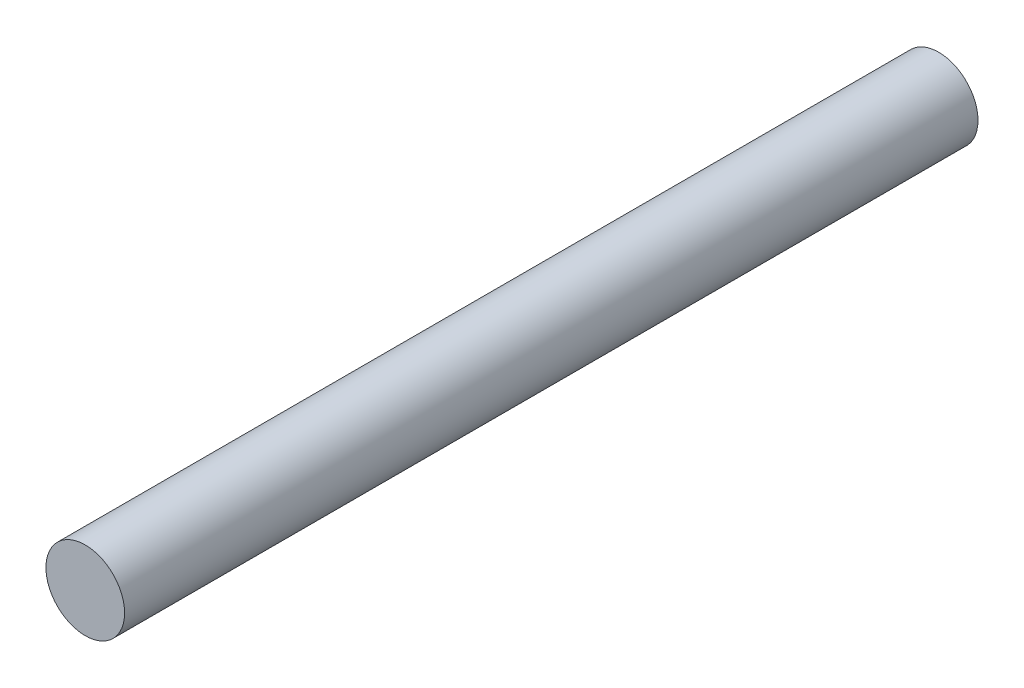
from build123d import *

# Parameters (mm, degrees)
SKETCH1_R           = 2.5
BOSS_EXTRUDE1_DEPTH = 54.24


with BuildPart() as part:
    # Sketch1 → Boss-Extrude1 (new body)
    with BuildSketch(Plane.XY):
        Circle(SKETCH1_R)
    extrude(amount=BOSS_EXTRUDE1_DEPTH)


solid = part.part
